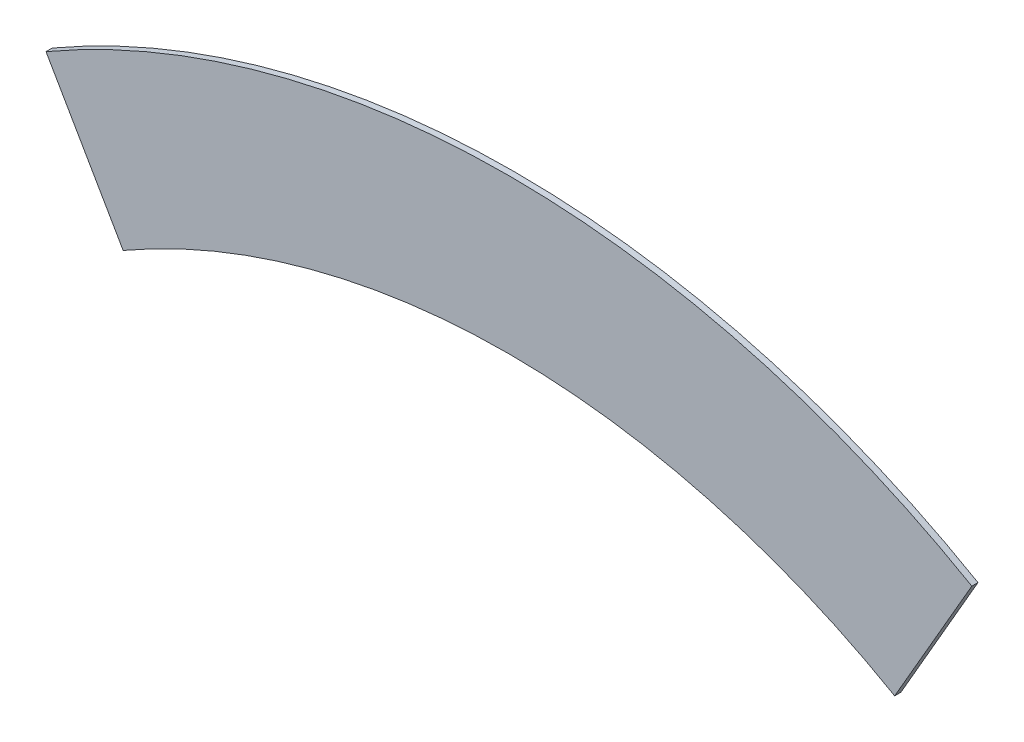
from build123d import *

# Parameters (mm, degrees)
RESSALTO_EXTRUS_O1_DEPTH = 0.2


with BuildPart() as part:
    # Esboço1 → Ressalto-extrusão1 (new body)
    with BuildSketch(Plane.XY):
        with BuildLine():
            Line((-12.5, 21.650635095), (-15, 25.980762114))
            ThreePointArc((-15, 25.980762114), (0, 30), (15, 25.980762114))
            Line((15, 25.980762114), (12.5, 21.650635095))
            ThreePointArc((12.5, 21.650635095), (0, 25), (-12.5, 21.650635095))
        make_face()
    extrude(amount=RESSALTO_EXTRUS_O1_DEPTH)


solid = part.part
